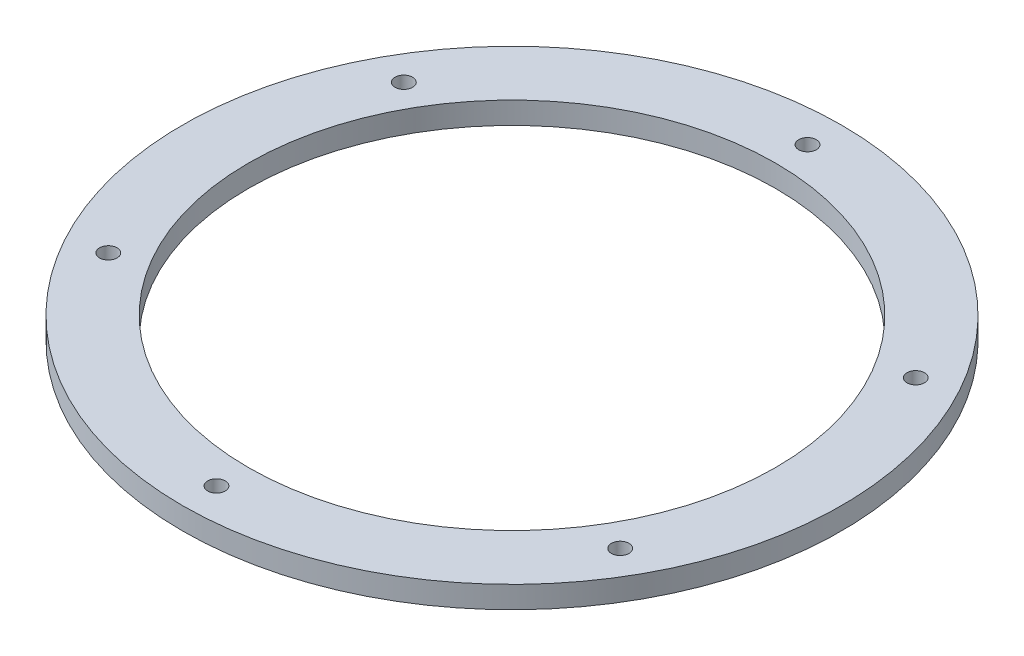
from build123d import *

# Parameters (mm, degrees)
SKETCH_1_R          = 75
SKETCH_1_R_2        = 60
EXTRUDE_1_DEPTH     = 5
SKETCH_2_R          = 2
CUT_EXTRUDE_1_DEPTH = 107.183802908


with BuildPart() as part:
    # Эскиз1 → Бобышка-Вытянуть1 (new body)
    with BuildSketch(Plane(origin=(0, 0, 0), x_dir=(1, 0, 0), z_dir=(0, 1, 0))):
        with Locations(Location((0, 0, 0), (0, 0, 270))):
            Circle(SKETCH_1_R)
        with Locations(Location((0, 0, 0), (0, 0, 270))):
            Circle(SKETCH_1_R_2, mode=Mode.SUBTRACT)
    extrude(amount=EXTRUDE_1_DEPTH)

    # Эскиз2 → Вырез-Вытянуть1 (cut, through all)
    with BuildSketch(Plane(origin=(0, 5, 0), x_dir=(1, 0, 0), z_dir=(0, 1, 0))):
        with Locations(Location((0, 67.254061919, 0), (0, 0, 270))):
            Circle(SKETCH_2_R)
        with Locations(Location((58.24372613, 33.62703096, 0), (0, 0, 270))):
            Circle(SKETCH_2_R)
        with Locations(Location((58.24372613, -33.62703096, 0), (0, 0, 270))):
            Circle(SKETCH_2_R)
        with Locations(Location((0, -67.254061919, 0), (0, 0, 270))):
            Circle(SKETCH_2_R)
        with Locations(Location((-58.24372613, -33.62703096, 0), (0, 0, 270))):
            Circle(SKETCH_2_R)
        with Locations(Location((-58.24372613, 33.62703096, 0), (0, 0, 270))):
            Circle(SKETCH_2_R)
    extrude(amount=-CUT_EXTRUDE_1_DEPTH, mode=Mode.SUBTRACT)


solid = part.part
